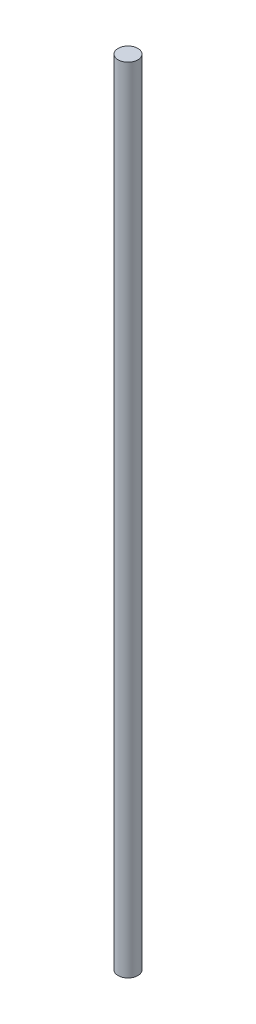
from build123d import *

# Parameters (mm, degrees)
SKETCH2_R            = 1.5
WATERWHEELAXEL_DEPTH = 120


with BuildPart() as part:
    # Sketch2 → WaterWheelAxel (new body)
    with BuildSketch(Plane(origin=(0, 0, 0), x_dir=(1, 0, 0), z_dir=(0, 1, 0))):
        with Locations(Location((0, 0, 0), (0, 0, 270))):
            Circle(SKETCH2_R)
    extrude(amount=WATERWHEELAXEL_DEPTH)


solid = part.part
